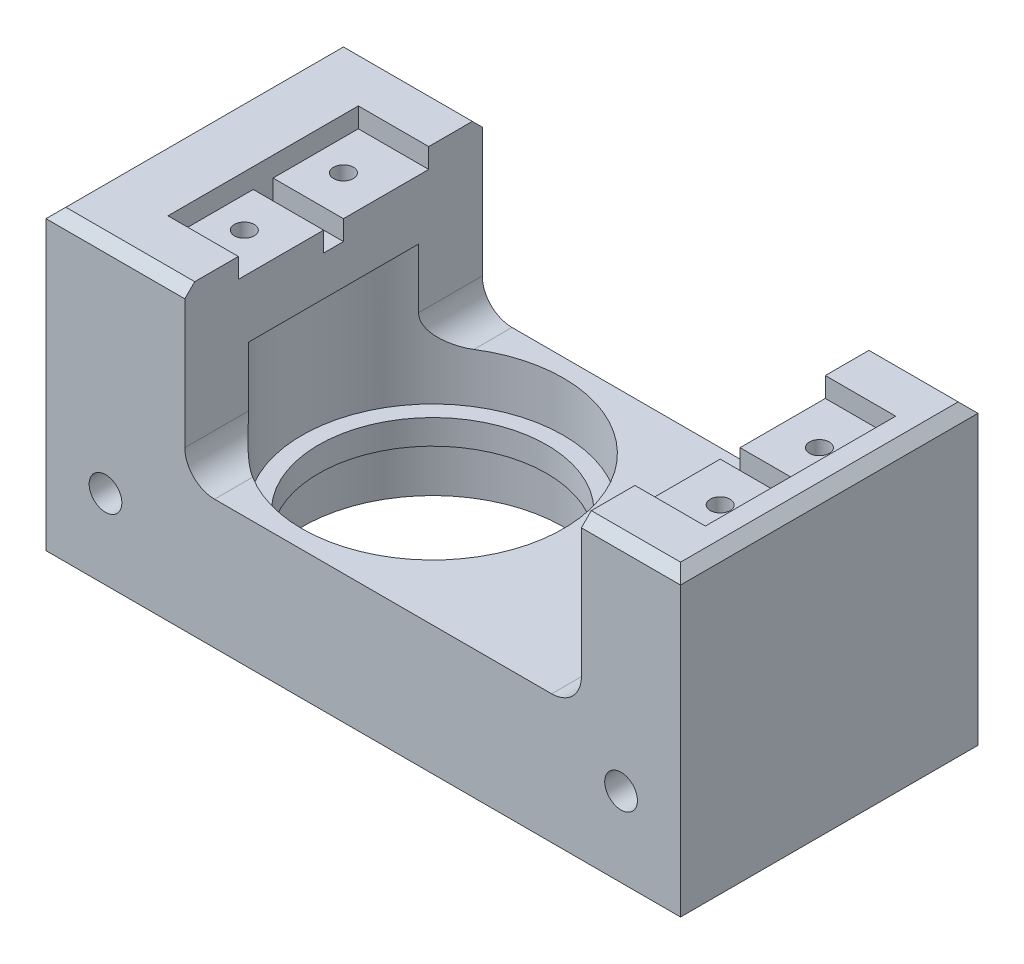
from build123d import *

# Parameters (mm, degrees)
SKETCH_1_W             = 64
SKETCH_1_H             = 30
EXTRUDE_545_DEPTH      = 13
SKETCH_2_R             = 13.175
CUT_EXTRUDE_683_DEPTH  = 5
CUT_EXTRUDE_START      = -5.5
SKETCH_3_R             = 13.175
CUT_EXTRUDE_807_DEPTH  = 5.5
SKETCH_4_R             = 11.5
CUT_EXTRUDE_897_DEPTH  = 44.462627624
EXTRUDE_START          = 3
SKETCH_8_W             = 64
SKETCH_8_H             = 30
SKETCH_8_R             = 13.175
EXTRUDE_1112_DEPTH     = 3
EXTRUDE_START_2        = 12
SKETCH_9_W             = 10
SKETCH_9_H             = 30
EXTRUDE_1450_DEPTH     = 12
SKETCH_10_R            = 1
CUT_EXTRUDE_1737_DEPTH = 12
SKETCH_11_R            = 1.65
CUT_EXTRUDE_2233_DEPTH = 58.306195128
SKETCH_12_W            = 10
SKETCH_12_H            = 5.4
EXTRUDE_2614_DEPTH     = 2
CUT_EXTRUDE_2853_DEPTH = 3
SKETCH_15_W            = 10
SKETCH_15_H            = 19.2
SKETCH_15_R            = 1
EXTRUDE_3124_DEPTH     = 9
CHAMFER_5_SIZE         = 3
SKETCH_17_W            = 2.9
SKETCH_17_H            = 19.2
EXTRUDE_3548_DEPTH     = 2
SKETCH_16_W            = 7.1
SKETCH_16_H            = 2
CUT_EXTRUDE_3829_DEPTH = 2
SKETCH_18_W            = 4
SKETCH_18_H            = 30
EXTRUDE_3994_DEPTH     = 14
FILLET_4_R             = 3
CHAMFER_7_SIZE         = 1


with BuildPart() as part:
    # Эскиз1 → Extrude 545 (new body)
    with BuildSketch(Plane(origin=(0, 0, 0), x_dir=(1, 0, 0), z_dir=(0, 1, 0))):
        with Locations((8, 0)):
            Rectangle(SKETCH_1_W, SKETCH_1_H)
    extrude(amount=EXTRUDE_545_DEPTH)

    # Эскиз2 → Cut-Extrude 683 (cut)
    with BuildSketch(Plane(origin=(0, 13, 0), x_dir=(1, 0, 0), z_dir=(0, 1, 0))):
        with Locations(Location((0, 0, 0), (0, 0, 270))):
            Circle(SKETCH_2_R)
    extrude(amount=-CUT_EXTRUDE_683_DEPTH, mode=Mode.SUBTRACT)

    # Эскиз3 → Cut-Extrude 807 (cut)
    with BuildSketch(Plane.XZ.offset(CUT_EXTRUDE_START)):
        with Locations(Location((0, 0, 0), (0, 0, 90))):
            Circle(SKETCH_3_R)
    extrude(amount=CUT_EXTRUDE_807_DEPTH, mode=Mode.SUBTRACT)

    # Эскиз4 → Cut-Extrude 897 (cut, through all)
    with BuildSketch(Plane(origin=(0, 8, 0), x_dir=(1, 0, 0), z_dir=(0, 1, 0))):
        with Locations(Location((0, 0, 0), (0, 0, 270))):
            Circle(SKETCH_4_R)
    extrude(amount=-CUT_EXTRUDE_897_DEPTH, mode=Mode.SUBTRACT)

    # Эскиз8 → Extrude 1112 (add)
    with BuildSketch(Plane(origin=(0, 13, 0), x_dir=(1, 0, 0), z_dir=(0, 1, 0)).offset(EXTRUDE_START)):
        with Locations((8, 0)):
            Rectangle(SKETCH_8_W, SKETCH_8_H)
        with Locations(Location((0, 0, 0), (0, 0, 270))):
            Circle(SKETCH_8_R, mode=Mode.SUBTRACT)
    extrude(amount=-EXTRUDE_1112_DEPTH)

    # Эскиз9 → Extrude 1450 (add)
    with BuildSketch(Plane(origin=(0, 16, 0), x_dir=(1, 0, 0), z_dir=(0, 1, 0)).offset(EXTRUDE_START_2)):
        with BuildLine():
            Line((-20, 15), (-10, 15))
            Line((-10, 15), (-10, 8.577914956))
            ThreePointArc((-10, 8.577914956), (-13.175, 0), (-10, -8.577914956))
            Line((-10, -8.577914956), (-10, -15))
            Line((-10, -15), (-20, -15))
            Line((-20, -15), (-20, 15))
        make_face()
        with Locations((35, 0)):
            Rectangle(SKETCH_9_W, SKETCH_9_H)
    extrude(amount=-EXTRUDE_1450_DEPTH)

    # Эскиз10 → Cut-Extrude 1737 (cut)
    with BuildSketch(Plane(origin=(0, 28, 0), x_dir=(1, 0, 0), z_dir=(0, 1, 0))):
        with Locations(Location((-14, 5, 0), (0, 0, 270))):
            Circle(SKETCH_10_R)
        with Locations(Location((-14, -5, 0), (0, 0, 270))):
            Circle(SKETCH_10_R)
        with Locations(Location((34, -5, 0), (0, 0, 270))):
            Circle(SKETCH_10_R)
        with Locations(Location((34, 5, 0), (0, 0, 270))):
            Circle(SKETCH_10_R)
    extrude(amount=-CUT_EXTRUDE_1737_DEPTH, mode=Mode.SUBTRACT)

    # Эскиз11 → Cut-Extrude 2233 (cut, through all)
    with BuildSketch(Plane.XY.offset(15)):
        with Locations((-18, 8)):
            Circle(SKETCH_11_R)
        with Locations((34, 8)):
            Circle(SKETCH_11_R)
    extrude(amount=-CUT_EXTRUDE_2233_DEPTH, mode=Mode.SUBTRACT)

    # Эскиз12 → Extrude 2614 (add)
    with BuildSketch(Plane(origin=(0, 28, 0), x_dir=(1, 0, 0), z_dir=(0, 1, 0))):
        with Locations((-15, 12.3)):
            Rectangle(SKETCH_12_W, SKETCH_12_H)
        with Locations((-15, -12.3)):
            Rectangle(SKETCH_12_W, SKETCH_12_H)
        with Locations((35, -12.3)):
            Rectangle(SKETCH_12_W, SKETCH_12_H)
        with Locations((35, 12.3)):
            Rectangle(SKETCH_12_W, SKETCH_12_H)
    extrude(amount=EXTRUDE_2614_DEPTH)

    # Эскиз14 → Cut-Extrude 2853 (cut)
    with BuildSketch(Plane(origin=(0, 16, 0), x_dir=(1, 0, 0), z_dir=(0, 1, 0))):
        with BuildLine():
            Line((-10, 15), (-10, 8.577914956))
            ThreePointArc((-10, 8.577914956), (13.175, 0), (-10, -8.577914956))
            Line((-10, -8.577914956), (-10, -15))
            Line((-10, -15), (30, -15))
            Line((30, -15), (30, 15))
            Line((30, 15), (-10, 15))
        make_face()
    extrude(amount=-CUT_EXTRUDE_2853_DEPTH, mode=Mode.SUBTRACT)

    # Эскиз15 → Extrude 3124 (add)
    with BuildSketch(Plane(origin=(0, 28, 0), x_dir=(1, 0, 0), z_dir=(0, 1, 0))):
        with Locations((-15, 0)):
            Rectangle(SKETCH_15_W, SKETCH_15_H)
        with Locations(Location((-14, 5, 0), (0, 0, 270))):
            Circle(SKETCH_15_R, mode=Mode.SUBTRACT)
        with Locations(Location((-14, -5, 0), (0, 0, 270))):
            Circle(SKETCH_15_R, mode=Mode.SUBTRACT)
    extrude(amount=-EXTRUDE_3124_DEPTH)

    # Фаска5
    chamfer_5_edges = [part.edges().sort_by_distance(p)[0] for p in [
        (-10, 19, 0),
    ]]
    chamfer(chamfer_5_edges, length=CHAMFER_5_SIZE)

    # Эскиз17 → Extrude 3548 (add)
    with BuildSketch(Plane(origin=(0, 28, 0), x_dir=(1, 0, 0), z_dir=(0, 1, 0))):
        with Locations((-18.55, 0)):
            Rectangle(SKETCH_17_W, SKETCH_17_H)
        with Locations((38.55, 0)):
            Rectangle(SKETCH_17_W, SKETCH_17_H)
    extrude(amount=EXTRUDE_3548_DEPTH)

    # Эскиз16 → Cut-Extrude 3829 (cut)
    with BuildSketch(Plane(origin=(0, 28, 0), x_dir=(1, 0, 0), z_dir=(0, 1, 0))):
        with Locations((-13.55, 0)):
            Rectangle(SKETCH_16_W, SKETCH_16_H)
        with Locations((33.55, 0)):
            Rectangle(SKETCH_16_W, SKETCH_16_H)
    extrude(amount=-CUT_EXTRUDE_3829_DEPTH, mode=Mode.SUBTRACT)

    # Эскиз18 → Extrude 3994 (add)
    with BuildSketch(Plane(origin=(0, 16, 0), x_dir=(1, 0, 0), z_dir=(0, 1, 0))):
        with Locations((-22, 0)):
            Rectangle(SKETCH_18_W, SKETCH_18_H)
    extrude(amount=EXTRUDE_3994_DEPTH)

    # Скругление4
    fillet_4_edges = [part.edges().sort_by_distance(p)[0] for p in [
        (30, 13, 0),
        (-10, 13, 11.788957478),
        (-10, 13, -11.788957478),
    ]]
    fillet(fillet_4_edges, radius=FILLET_4_R)

    # Фаска7
    chamfer_7_edges = [part.edges().sort_by_distance(p)[0] for p in [
        (-17, 30, -15),
        (-17, 30, 15),
        (40, 30, 0),
        (35, 30, 15),
        (35, 30, -15),
        (-24, 30, 0),
    ]]
    chamfer(chamfer_7_edges, length=CHAMFER_7_SIZE)


solid = part.part
